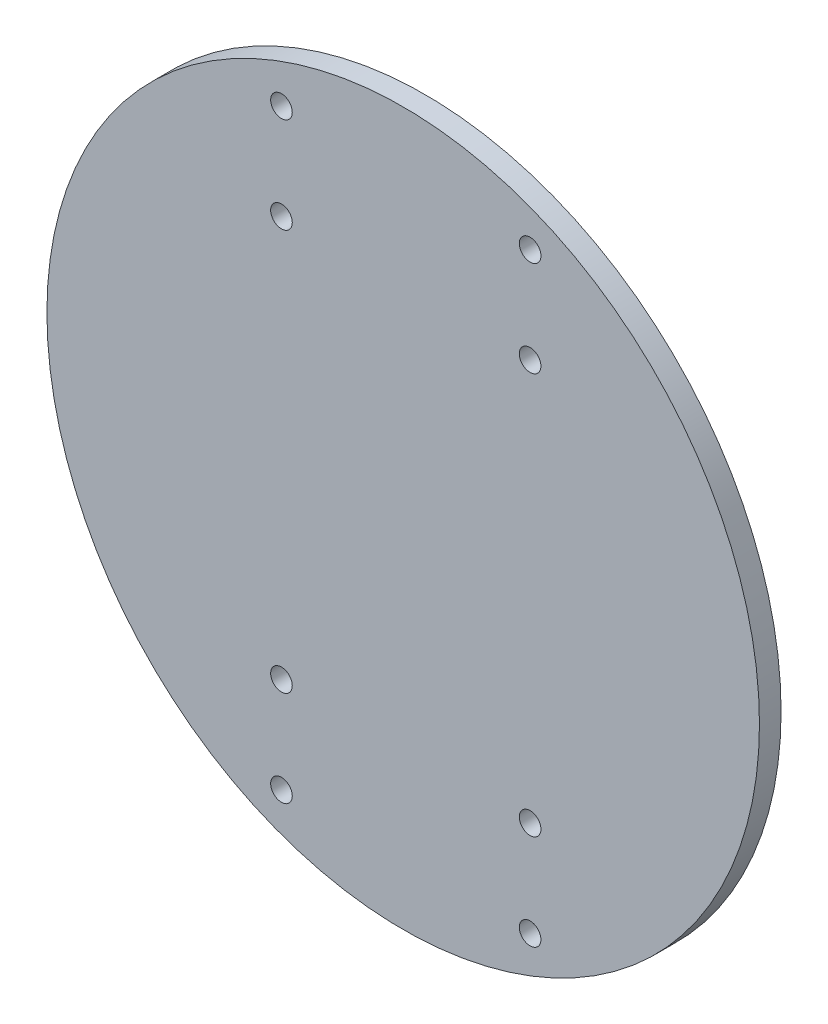
from build123d import *

# Parameters (mm, degrees)
CROQUIS1_R              = 82.42
SALIENTE_EXTRUIR1_DEPTH = 5
CROQUIS3_R              = 2.5
CORTAR_EXTRUIR1_DEPTH   = 5


with BuildPart() as part:
    # Croquis1 → Saliente-Extruir1 (new body)
    with BuildSketch(Plane.XY):
        Circle(CROQUIS1_R)
    extrude(amount=SALIENTE_EXTRUIR1_DEPTH)

    # Croquis3 → Cortar-Extruir1 (cut, symmetric)
    with BuildSketch(Plane.XY.offset(5)):
        with Locations((29.36, 46.39)):
            Circle(CROQUIS3_R)
        with Locations((-28.16, 68.49)):
            Circle(CROQUIS3_R)
        with Locations((29.36, -46.39)):
            Circle(CROQUIS3_R)
        with Locations((-28.16, -46.39)):
            Circle(CROQUIS3_R)
        with Locations((29.36, -68.49)):
            Circle(CROQUIS3_R)
        with Locations(Location((29.36, 68.49, 0), (0, 0, 180))):
            Circle(CROQUIS3_R)
        with Locations(Location((-28.16, 46.39, 0), (0, 0, 180))):
            Circle(CROQUIS3_R)
        with Locations((-28.16, -68.49)):
            Circle(CROQUIS3_R)
    extrude(amount=CORTAR_EXTRUIR1_DEPTH, both=True, mode=Mode.SUBTRACT)


solid = part.part
